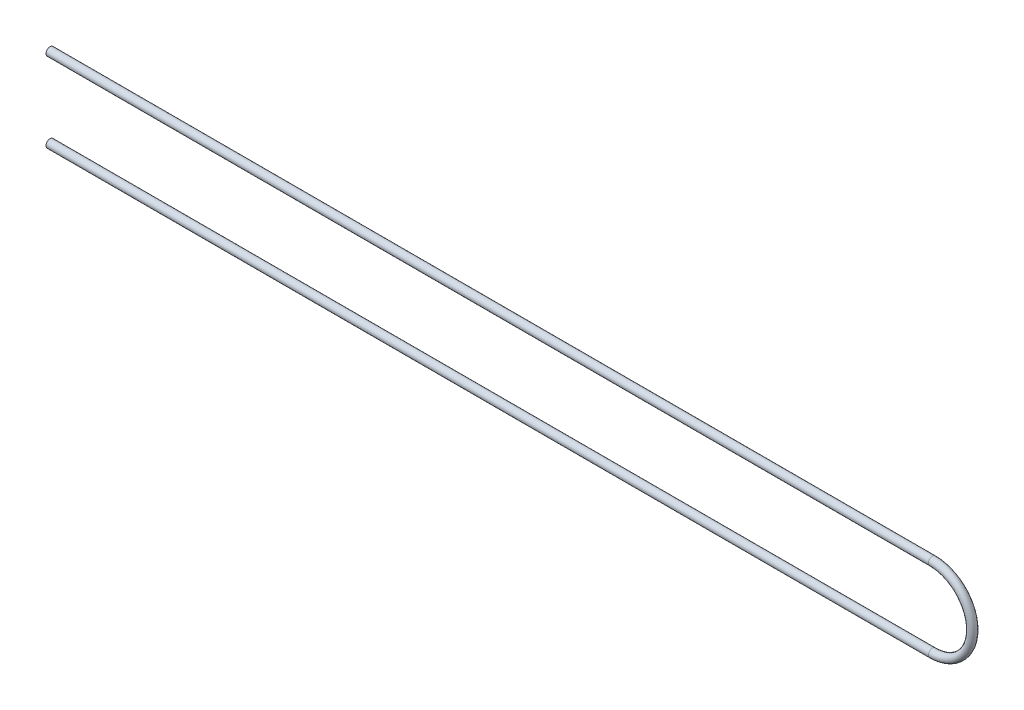
from build123d import *

# Parameters (mm, degrees)
SWEEP_THIN1_PROFILE_R   = 10.65
SWEEP_THIN1_PROFILE_R_2 = 10.15


with BuildPart() as part:
    # Sweep-Thin1: sweep along a path in Sketch1
    with BuildLine(Plane.XY) as sweep_thin1_path:
        Line((0, 0), (2325, 0))
        ThreePointArc((2325, 0), (2430, -105), (2325, -210))
        Line((2325, -210), (0, -210))
    # Sweep-Thin1 profile (on start of the path) → Sweep-Thin1 (sweep)
    with BuildSketch(Plane(origin=(0, 0, 0), x_dir=(0, 0, 1), z_dir=(1, 0, 0))):
        Circle(SWEEP_THIN1_PROFILE_R)
        Circle(SWEEP_THIN1_PROFILE_R_2, mode=Mode.SUBTRACT)
    sweep(path=sweep_thin1_path.line)


solid = part.part
